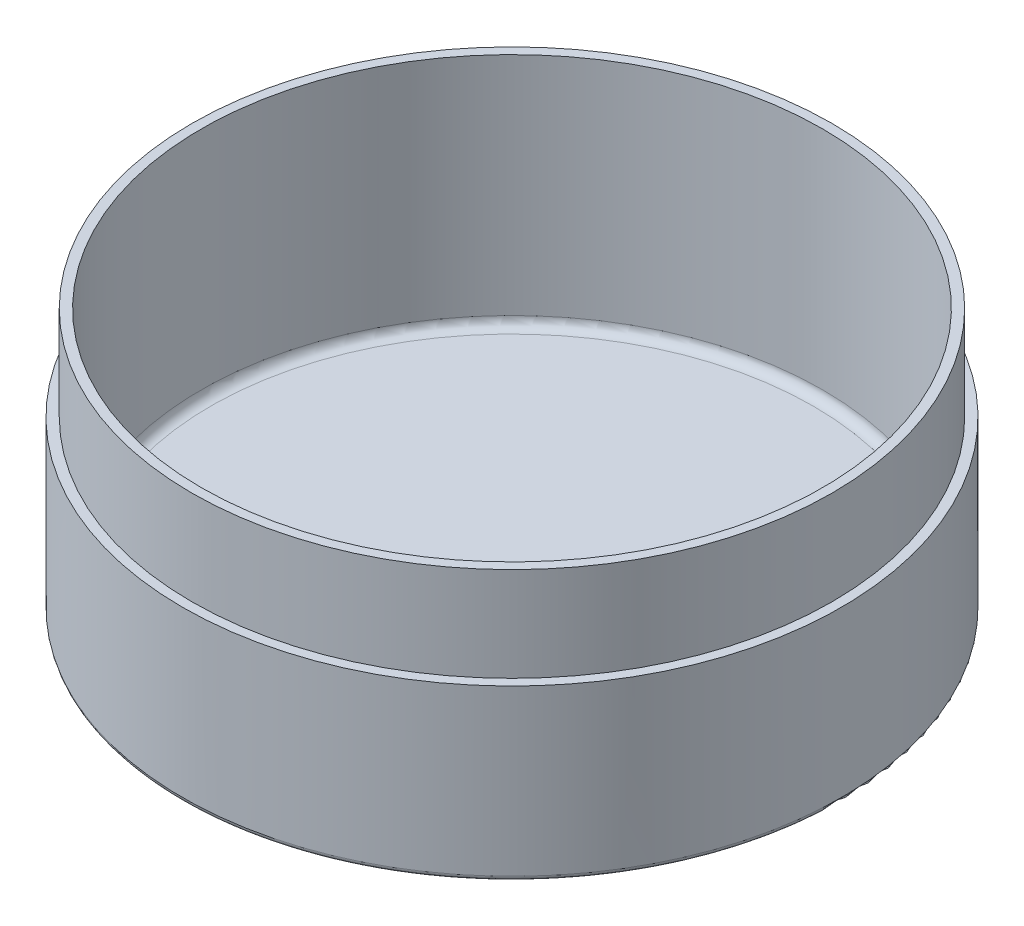
from build123d import *

# Parameters (mm, degrees)
SKETCH1_R           = 35
SKETCH1_R_2         = 33
BOSS_EXTRUDE1_DEPTH = 25
EXTRUDE_START       = 3
SKETCH_1_R          = 35
EXTRUDE_1_DEPTH     = 3
CUT_EXTRUDE_START   = -10
SKETCH_3_R          = 35
SKETCH_3_R_2        = 34
CUT_EXTRUDE_1_DEPTH = 10
FILLET_1_R          = 1
FILLET_2_R          = 0.5


with BuildPart() as part:
    # Sketch1 → Boss-Extrude1 (new body)
    with BuildSketch(Plane(origin=(0, 0, 0), x_dir=(1, 0, 0), z_dir=(0, 1, 0))):
        with Locations(Location((0, 0, 0), (0, 0, 270))):
            Circle(SKETCH1_R)
        with Locations(Location((0, 0, 0), (0, 0, 270))):
            Circle(SKETCH1_R_2, mode=Mode.SUBTRACT)
    extrude(amount=BOSS_EXTRUDE1_DEPTH)

    # Эскиз1 → Бобышка-Вытянуть1 (add)
    with BuildSketch(Plane.XZ.offset(EXTRUDE_START)):
        with Locations(Location((0, 0, 0), (0, 0, 270))):
            Circle(SKETCH_1_R)
    extrude(amount=-EXTRUDE_1_DEPTH)

    # Эскиз3 → Вырез-Вытянуть1 (cut)
    with BuildSketch(Plane(origin=(0, 25, 0), x_dir=(1, 0, 0), z_dir=(0, 1, 0)).offset(CUT_EXTRUDE_START)):
        with Locations(Location((0, 0, 0), (0, 0, 90))):
            Circle(SKETCH_3_R)
        with Locations(Location((0, 0, 0), (0, 0, 270))):
            Circle(SKETCH_3_R_2, mode=Mode.SUBTRACT)
    extrude(amount=CUT_EXTRUDE_1_DEPTH, mode=Mode.SUBTRACT)

    # Скругление1
    fillet_1_edges = [part.edges().sort_by_distance(p)[0] for p in [
        (0, 0, -33),
    ]]
    fillet(fillet_1_edges, radius=FILLET_1_R)

    # Скругление2
    fillet_2_edges = [part.edges().sort_by_distance(p)[0] for p in [
        (0, -3, 35),
    ]]
    fillet(fillet_2_edges, radius=FILLET_2_R)


solid = part.part
